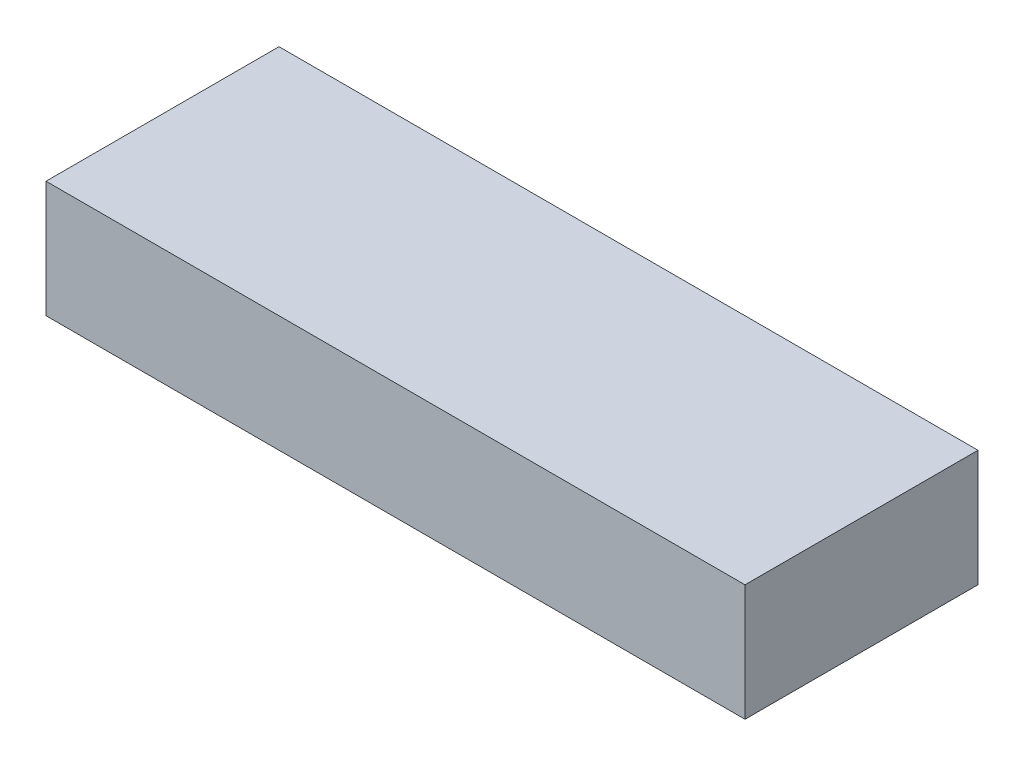
from build123d import *

# Parameters (mm, degrees)
SKETCH1_W           = 304.8
SKETCH1_H           = 101.6
BOSS_EXTRUDE1_DEPTH = 50.8


with BuildPart() as part:
    # Sketch1 → Boss-Extrude1 (new body)
    with BuildSketch(Plane(origin=(0, 0, 0), x_dir=(1, 0, 0), z_dir=(0, 1, 0))):
        Rectangle(SKETCH1_W, SKETCH1_H)
    extrude(amount=BOSS_EXTRUDE1_DEPTH)


solid = part.part
